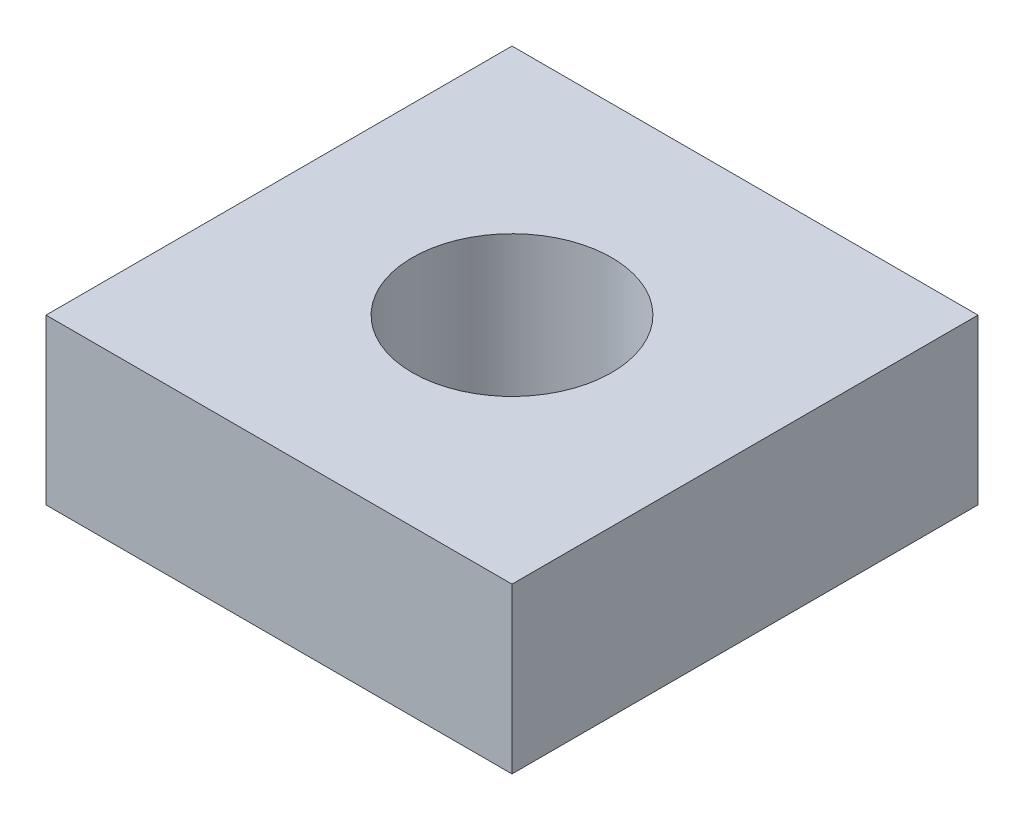
from build123d import *

# Parameters (mm, degrees)
SKETCH2_W           = 9
SKETCH2_H           = 9
SKETCH2_R           = 1.925
BOSS_EXTRUDE1_DEPTH = 3.175


with BuildPart() as part:
    # Sketch2 → Boss-Extrude1 (new body)
    with BuildSketch(Plane(origin=(0, 0, 0), x_dir=(1, 0, 0), z_dir=(0, 1, 0))):
        with Locations((-4.5, 4.5)):
            Rectangle(SKETCH2_W, SKETCH2_H)
        with Locations(Location((-4.5, 4.5, 0), (0, 0, 270))):
            Circle(SKETCH2_R, mode=Mode.SUBTRACT)
    extrude(amount=BOSS_EXTRUDE1_DEPTH)


solid = part.part
